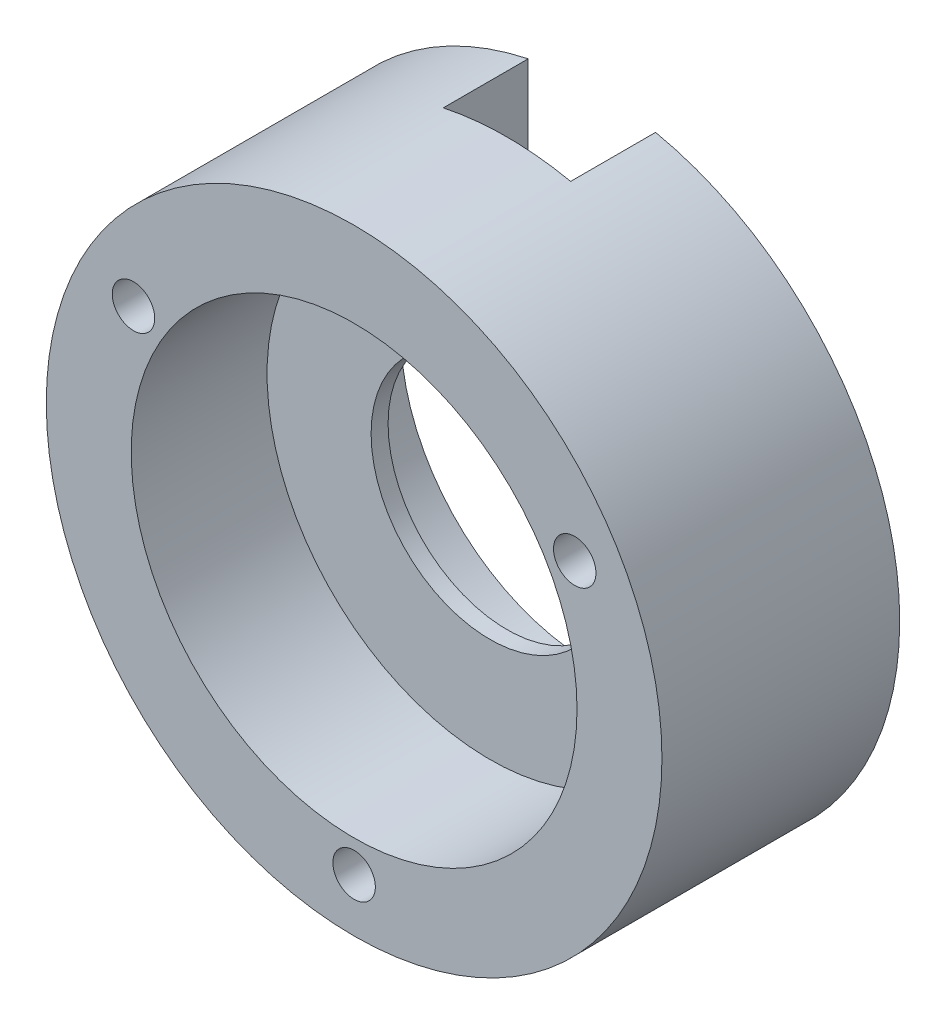
from build123d import *

# Parameters (mm, degrees)
SKETCH1_R           = 36.25
SKETCH1_R_2         = 26.25
BOSS_EXTRUDE1_DEPTH = 16
BOSS_EXTRUDE2_START = 12
SKETCH2_R           = 36.25
SKETCH2_R_2         = 14
BOSS_EXTRUDE2_DEPTH = 12
SKETCH4_W           = 15
SKETCH4_H           = 30
CUT_EXTRUDE1_DEPTH  = 10
SKETCH5_R           = 22.5
CUT_EXTRUDE2_DEPTH  = 10
SKETCH7_R           = 2.5
CUT_EXTRUDE3_DEPTH  = 59.413397436


with BuildPart() as part:
    # Sketch1 → Boss-Extrude1 (new body)
    with BuildSketch(Plane.XY):
        Circle(SKETCH1_R)
        Circle(SKETCH1_R_2, mode=Mode.SUBTRACT)
    extrude(amount=BOSS_EXTRUDE1_DEPTH)

    # Sketch2 → Boss-Extrude2 (add)
    with BuildSketch(Plane(origin=(0, 0, 0), x_dir=(-1, 0, 0), z_dir=(0, 0, -1)).offset(BOSS_EXTRUDE2_START)):
        Circle(SKETCH2_R)
        Circle(SKETCH2_R_2, mode=Mode.SUBTRACT)
    extrude(amount=-BOSS_EXTRUDE2_DEPTH)

    # Sketch4 → Cut-Extrude1 (cut)
    with BuildSketch(Plane(origin=(0, 0, -12), x_dir=(-1, 0, 0), z_dir=(0, 0, -1))):
        with Locations((0, 23)):
            Rectangle(SKETCH4_W, SKETCH4_H)
    extrude(amount=-CUT_EXTRUDE1_DEPTH, mode=Mode.SUBTRACT)

    # Sketch5 → Cut-Extrude2 (cut)
    with BuildSketch(Plane(origin=(0, 0, -12), x_dir=(-1, 0, 0), z_dir=(0, 0, -1))):
        Circle(SKETCH5_R)
    extrude(amount=-CUT_EXTRUDE2_DEPTH, mode=Mode.SUBTRACT)

    # Sketch7 → Cut-Extrude3 (cut, through all)
    with BuildSketch(Plane(origin=(0, 0, -12), x_dir=(-1, 0, 0), z_dir=(0, 0, -1))):
        with Locations((-25.980762114, 15)):
            Circle(SKETCH7_R)
        with Locations((25.980762114, 15)):
            Circle(SKETCH7_R)
        with Locations((0, -30)):
            Circle(SKETCH7_R)
    extrude(amount=-CUT_EXTRUDE3_DEPTH, mode=Mode.SUBTRACT)


solid = part.part
